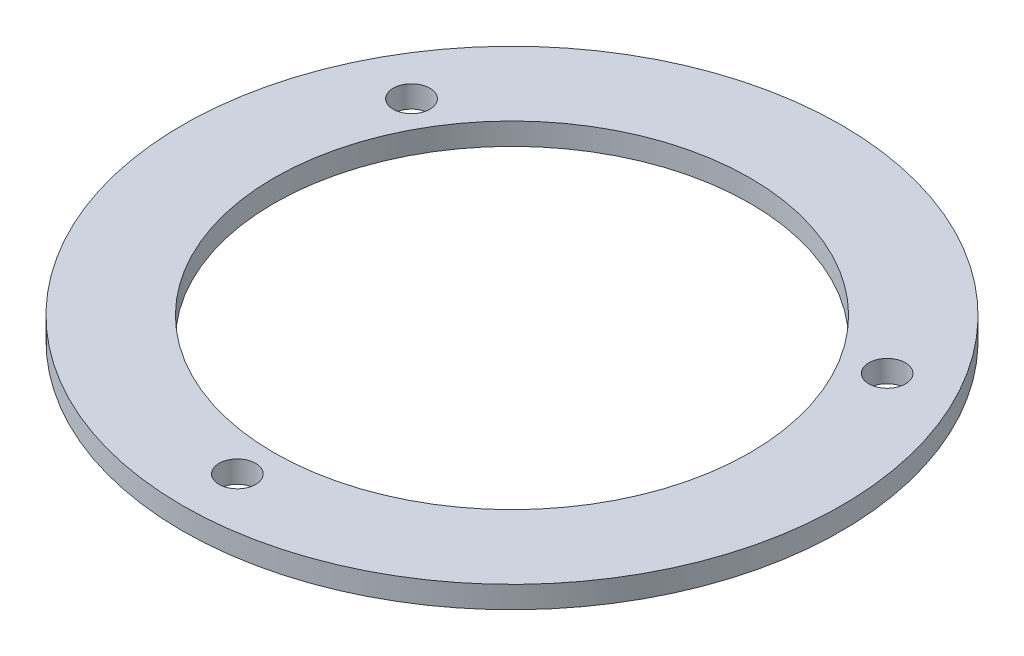
from build123d import *

# Parameters (mm, degrees)
SKETCH1_R                       = 57.15
BOSS_EXTRUDE1_DEPTH             = 63.5
SKETCH2_R                       = 41.275
CUT_EXTRUDE1_DEPTH              = 53.34
F_1_4_0_25_DIAMETER_HOLE4_D     = 6.35
F_1_4_0_25_DIAMETER_HOLE4_DEPTH = 25.4
F_1_4_0_25_DIAMETER_HOLE4_TIP   = 1.907732465
SKETCH7_R                       = 3.81
CUT_EXTRUDE2_DEPTH              = 103.783729257
F_4_0MM_DOWEL_HOLE1_D           = 4
SKETCH9_W                       = 7
SKETCH9_H                       = 7
CUT_EXTRUDE3_DEPTH              = 3.5
SKETCH12_W                      = 12.7
SKETCH12_H                      = 19.05
CUT_EXTRUDE4_DEPTH              = 4.7625
SKETCH13_R                      = 64.794556677
CUT_EXTRUDE5_DEPTH              = 59.69


with BuildPart() as part:
    # Sketch1 → Boss-Extrude1 (new body)
    with BuildSketch(Plane(origin=(0, 0, 0), x_dir=(1, 0, 0), z_dir=(0, 1, 0))):
        with Locations(Location((0, 0, 0), (0, 0, 270))):
            Circle(SKETCH1_R)
    extrude(amount=BOSS_EXTRUDE1_DEPTH)

    # Sketch2 → Cut-Extrude1 (cut)
    with BuildSketch(Plane(origin=(0, 63.5, 0), x_dir=(1, 0, 0), z_dir=(0, 1, 0))):
        with Locations(Location((0, 0, 0), (0, 0, 270))):
            Circle(SKETCH2_R)
    extrude(amount=-CUT_EXTRUDE1_DEPTH, mode=Mode.SUBTRACT)

    # 1/4 (0.25) Diameter Hole4
    with Locations(Plane(origin=(0, 63.5, 0), x_dir=(1, 0, 0), z_dir=(0, 1, 0))):
        with Locations((-41.244459855, 23.8125), (0, -47.625), (41.244459855, 23.8125)):
            Hole(F_1_4_0_25_DIAMETER_HOLE4_D / 2, depth=F_1_4_0_25_DIAMETER_HOLE4_DEPTH)
            with Locations((0, 0, -(F_1_4_0_25_DIAMETER_HOLE4_DEPTH + F_1_4_0_25_DIAMETER_HOLE4_TIP / 2))):  # 118° drill point
                Cone(0, F_1_4_0_25_DIAMETER_HOLE4_D / 2, F_1_4_0_25_DIAMETER_HOLE4_TIP, mode=Mode.SUBTRACT)

    # Sketch7 → Cut-Extrude2 (cut, through all)
    with BuildSketch(Plane.XY):
        with Locations((0, 15.24)):
            Circle(SKETCH7_R)
    extrude(amount=-CUT_EXTRUDE2_DEPTH, mode=Mode.SUBTRACT)

    # Ø4.0mm Dowel Hole1 (through all)
    with Locations(Plane(origin=(-5, 0, 15.938504039), x_dir=(0, 0, -1), z_dir=(0, -1, 0))):
        with Locations((0, 0), (0, 10), (49.5, 10), (49.5, 0)):
            Hole(F_4_0MM_DOWEL_HOLE1_D / 2)

    # Sketch9 → Cut-Extrude3 (cut)
    with BuildSketch(Plane.XZ):
        with Locations((-5, 15.938504039)):
            Rectangle(SKETCH9_W, SKETCH9_H)
        with Locations((5, 15.938504039)):
            Rectangle(SKETCH9_W, SKETCH9_H)
        with Locations((5, -33.561495961)):
            Rectangle(SKETCH9_W, SKETCH9_H)
        with Locations((-5, -33.561495961)):
            Rectangle(SKETCH9_W, SKETCH9_H)
    extrude(amount=-CUT_EXTRUDE3_DEPTH, mode=Mode.SUBTRACT)

    # Sketch12 → Cut-Extrude4 (cut)
    with BuildSketch(Plane(origin=(0, 50.8, 0), x_dir=(1, 0, 0), z_dir=(0, 1, 0))):
        Polygon((-54.992429237, 24.417545405), (-38.494645295, 14.892545405), (-35.319645295, 20.391806719), (-51.817429237, 29.916806719), align=None)
        Polygon((-51.817429237, 29.916806719), (-35.319645295, 20.391806719), (-32.144645295, 25.891068033), (-48.642429237, 35.416068033), align=None)
        Polygon((32.144645295, 25.891068033), (35.319645295, 20.391806719), (51.817429237, 29.916806719), (48.642429237, 35.416068033), align=None)
        Polygon((51.817429237, 29.916806719), (35.319645295, 20.391806719), (38.494645295, 14.892545405), (54.992429237, 24.417545405), align=None)
        with Locations((0, -50.308613437)):
            Rectangle(SKETCH12_W, SKETCH12_H)
    extrude(amount=CUT_EXTRUDE4_DEPTH, mode=Mode.SUBTRACT)

    # Sketch13 → Cut-Extrude5 (cut)
    with BuildSketch(Plane.XZ):
        Circle(SKETCH13_R)
    extrude(amount=-CUT_EXTRUDE5_DEPTH, mode=Mode.SUBTRACT)


solid = part.part
